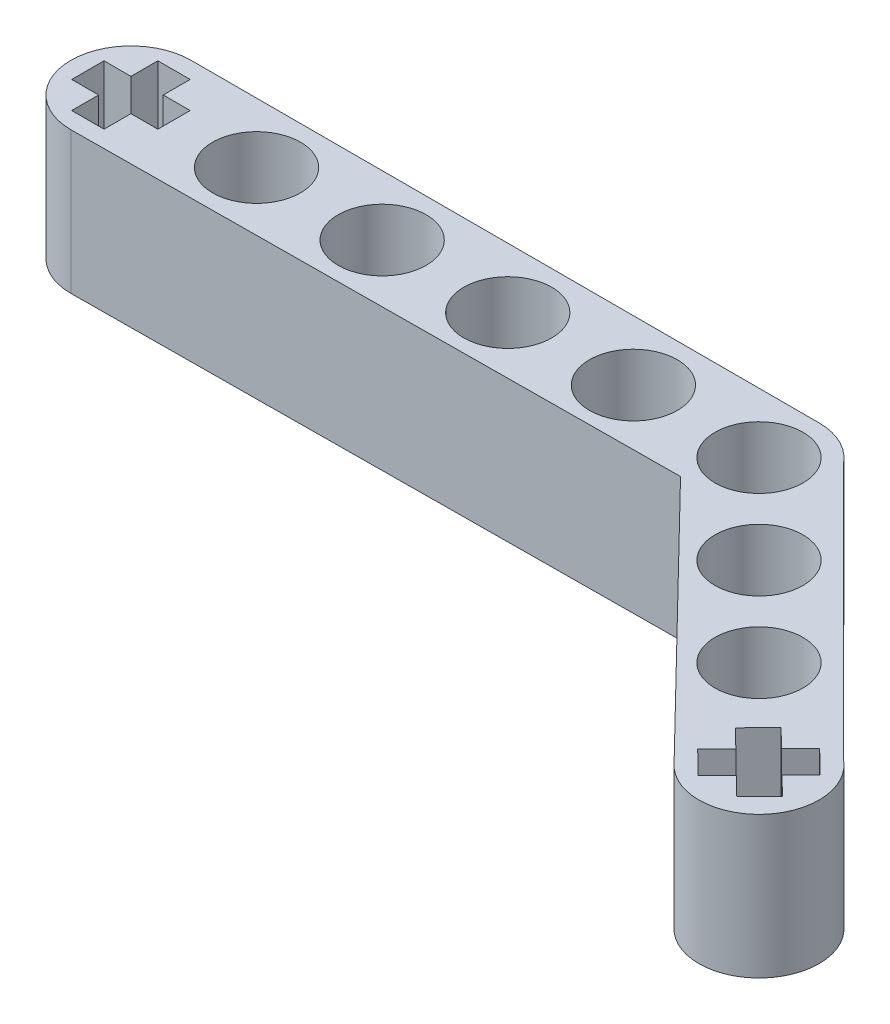
from build123d import *

# Parameters (mm, degrees)
SKETCH1_R           = 2.45
BOSS_EXTRUDE2_DEPTH = 7.9
CUT_EXTRUDE1_DEPTH  = 7.9
CUT_EXTRUDE2_DEPTH  = 7.9


with BuildPart() as part:
    # Sketch1 → Boss-Extrude2 (new body)
    with BuildSketch(Plane(origin=(0, 0, 0), x_dir=(1, 0, 0), z_dir=(0, 1, 0))):
        with BuildLine():
            Line((52.027202313, -12.303856257), (37.545386148, 2.177959908))
            ThreePointArc((37.545386148, 2.177959908), (36.40113067, 3.042915189), (35, 3.35))
            Line((35, 3.35), (0, 3.35))
            ThreePointArc((0, 3.35), (-3.35, 0), (0, -3.35))
            Line((0, -3.35), (33.72619107, -3.098372284))
            Line((33.72619107, -3.098372284), (47.353836826, -17.084292963))
            ThreePointArc((47.353836826, -17.084292963), (52.244724969, -17.191071452), (52.027202313, -12.303856257))
        make_face()
        with Locations(Location((44.899494937, -9.899494937, 0), (0, 0, 270))):
            Circle(SKETCH1_R, mode=Mode.SUBTRACT)
        with Locations(Location((39.949747468, -4.949747468, 0), (0, 0, 270))):
            Circle(SKETCH1_R, mode=Mode.SUBTRACT)
        with Locations(Location((7, 0, 0), (0, 0, 270))):
            Circle(SKETCH1_R, mode=Mode.SUBTRACT)
        with Locations(Location((14, 0, 0), (0, 0, 270))):
            Circle(SKETCH1_R, mode=Mode.SUBTRACT)
        with Locations(Location((21, 0, 0), (0, 0, 270))):
            Circle(SKETCH1_R, mode=Mode.SUBTRACT)
        with Locations(Location((35, 0, 0), (0, 0, 270))):
            Circle(SKETCH1_R, mode=Mode.SUBTRACT)
        with Locations(Location((28, 0, 0), (0, 0, 270))):
            Circle(SKETCH1_R, mode=Mode.SUBTRACT)
    extrude(amount=BOSS_EXTRUDE2_DEPTH)

    # Sketch2 → Cut-Extrude1 (cut)
    with BuildSketch(Plane(origin=(0, 7.9, 0), x_dir=(1, 0, 0), z_dir=(0, 1, 0))):
        Polygon((0, 2.4), (0, 0), (0, -2.4), (0.9, -2.4), (0.9, -0.9), (2.4, -0.9), (2.4, 0.9), (0.9, 0.9), (0.9, 2.4), align=None)
        Polygon((-2.4, 0), (0, 0), (0, 2.4), (-0.9, 2.4), (-0.9, 0.9), (-2.4, 0.9), align=None)
        Polygon((0, -2.4), (0, 0), (-2.4, 0), (-2.4, -0.9), (-0.9, -0.9), (-0.9, -2.4), align=None)
    extrude(amount=-CUT_EXTRUDE1_DEPTH, mode=Mode.SUBTRACT)

    # Sketch3 → Cut-Extrude2 (cut)
    with BuildSketch(Plane(origin=(0, 7.9, 0), x_dir=(1, 0, 0), z_dir=(0, 1, 0))):
        Polygon((49.704933947, -15.966785192), (49.061371467, -15.33763709), (48.010311985, -16.412777338), (48.653874465, -17.041925441), align=None)
        Polygon((48.010311985, -16.412777338), (49.061371467, -15.33763709), (48.417808987, -14.708488988), (47.366749505, -15.783629236), align=None)
        Polygon((49.061371467, -15.33763709), (49.690519569, -14.69407461), (49.04695709, -14.064926508), (48.417808987, -14.708488988), align=None)
        Polygon((50.334082049, -15.323222713), (49.690519569, -14.69407461), (49.061371467, -15.33763709), (49.704933947, -15.966785192), align=None)
        Polygon((51.368247842, -16.334225476), (50.334082049, -15.323222713), (49.704933947, -15.966785192), (50.73909974, -16.977787956), align=None)
        Polygon((51.997395944, -15.690662997), (50.963230152, -14.679660233), (50.334082049, -15.323222713), (51.368247842, -16.334225476), align=None)
        Polygon((50.963230152, -14.679660233), (50.319667672, -14.05051213), (49.690519569, -14.69407461), (50.334082049, -15.323222713), align=None)
        Polygon((52.014289634, -13.604519984), (51.370727154, -12.975371882), (50.319667672, -14.05051213), (50.963230152, -14.679660233), align=None)
        Polygon((50.319667672, -14.05051213), (51.370727154, -12.975371882), (50.727164674, -12.34622378), (49.676105192, -13.421364028), align=None)
        Polygon((49.690519569, -14.69407461), (50.319667672, -14.05051213), (49.676105192, -13.421364028), (49.04695709, -14.064926508), align=None)
        Polygon((49.04695709, -14.064926508), (49.676105192, -13.421364028), (48.641939399, -12.410361264), (48.012791297, -13.053923744), align=None)
        Polygon((48.417808987, -14.708488988), (49.04695709, -14.064926508), (48.012791297, -13.053923744), (47.383643195, -13.697486224), align=None)
    extrude(amount=-CUT_EXTRUDE2_DEPTH, mode=Mode.SUBTRACT)


solid = part.part
